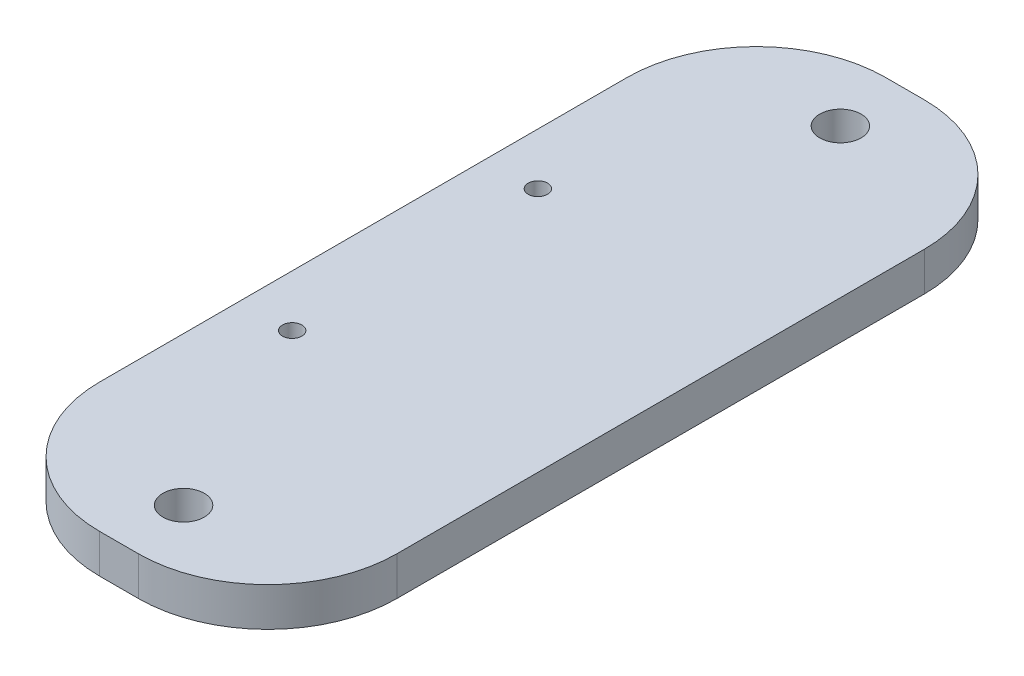
from build123d import *

# Parameters (mm, degrees)
SKETCH1_W           = 23
SKETCH1_H           = 60.8
SKETCH1_R           = 0.75
SKETCH1_R_2         = 1.6
BOSS_EXTRUDE1_DEPTH = 3
FILLET1_R           = 10


with BuildPart() as part:
    # Sketch1 → Boss-Extrude1 (new body)
    with BuildSketch(Plane(origin=(0, 0, 0), x_dir=(1, 0, 0), z_dir=(0, 1, 0))):
        Rectangle(SKETCH1_W, SKETCH1_H)
        with Locations(Location((-7.5, 9.5, 0), (0, 0, 270))):
            Circle(SKETCH1_R, mode=Mode.SUBTRACT)
        with Locations(Location((-7.5, -9.5, 0), (0, 0, 270))):
            Circle(SKETCH1_R, mode=Mode.SUBTRACT)
        with Locations(Location((0, 25.4, 0), (0, 0, 270))):
            Circle(SKETCH1_R_2, mode=Mode.SUBTRACT)
        with Locations(Location((0, -25.4, 0), (0, 0, 270))):
            Circle(SKETCH1_R_2, mode=Mode.SUBTRACT)
    extrude(amount=BOSS_EXTRUDE1_DEPTH)

    # Fillet1
    fillet1_edges = [part.edges().sort_by_distance(p)[0] for p in [
        (11.5, 1.5, 30.4),
        (-11.5, 1.5, 30.4),
        (-11.5, 1.5, -30.4),
        (11.5, 1.5, -30.4),
    ]]
    fillet(fillet1_edges, radius=FILLET1_R)


solid = part.part
